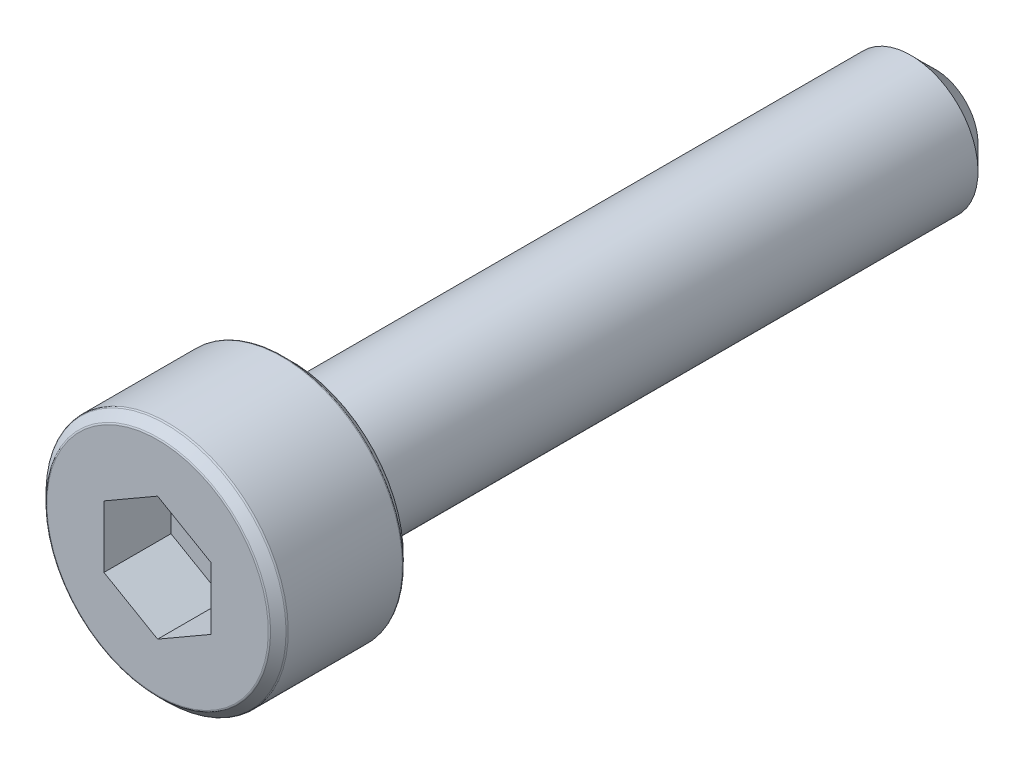
from build123d import *

# Parameters (mm, degrees)
CUT_EXTRUDE1_DEPTH = 1.25


with BuildPart() as part:
    # Sketch3 → Revolve1 (revolve)
    with BuildSketch(Plane(origin=(0, 0, 0), x_dir=(0, 0, -1), z_dir=(1, 0, 0)), mode=Mode.PRIVATE) as revolve1_sk:
        with BuildLine():
            Line((-7.25, 2.063775365), (-7.25, 1))
            Line((-7.25, 1), (-6, 1))
            Line((-6, 1), (-6, 0))
            Line((-6, 0), (7.25, 0))
            Line((7.25, 0), (7.25, 0.795336663))
            Line((7.25, 0.795336663), (6.795336663, 1.25))
            Line((6.795336663, 1.25), (-4.75, 1.25))
            Line((-4.75, 1.25), (-4.75, 2.063775365))
            ThreePointArc((-4.75, 2.063775365), (-4.753211332, 2.079919823), (-4.762356433, 2.093606433))
            Line((-4.762356433, 2.093606433), (-4.906393567, 2.237643567))
            ThreePointArc((-4.906393567, 2.237643567), (-4.920080177, 2.246788668), (-4.936224635, 2.25))
            Line((-4.936224635, 2.25), (-7.063775365, 2.25))
            ThreePointArc((-7.063775365, 2.25), (-7.079919823, 2.246788668), (-7.093606433, 2.237643567))
            Line((-7.093606433, 2.237643567), (-7.237643567, 2.093606433))
            ThreePointArc((-7.237643567, 2.093606433), (-7.246788668, 2.079919823), (-7.25, 2.063775365))
        make_face()
    revolve(revolve1_sk.sketch.rotate(Axis((0, 0, 7.25), (0, 0, -1)), 180), axis=Axis((0, 0, 7.25), (0, 0, -1)))

    # Sketch4 → Cut-Extrude1 (cut)
    with BuildSketch(Plane.XY.offset(7.25)):
        Polygon((0, 1.154700538), (-1, 0.577350269), (-1, -0.577350269), (0, -1.154700538), (1, -0.577350269), (1, 0.577350269), align=None)
    extrude(amount=-CUT_EXTRUDE1_DEPTH, mode=Mode.SUBTRACT)


solid = part.part
